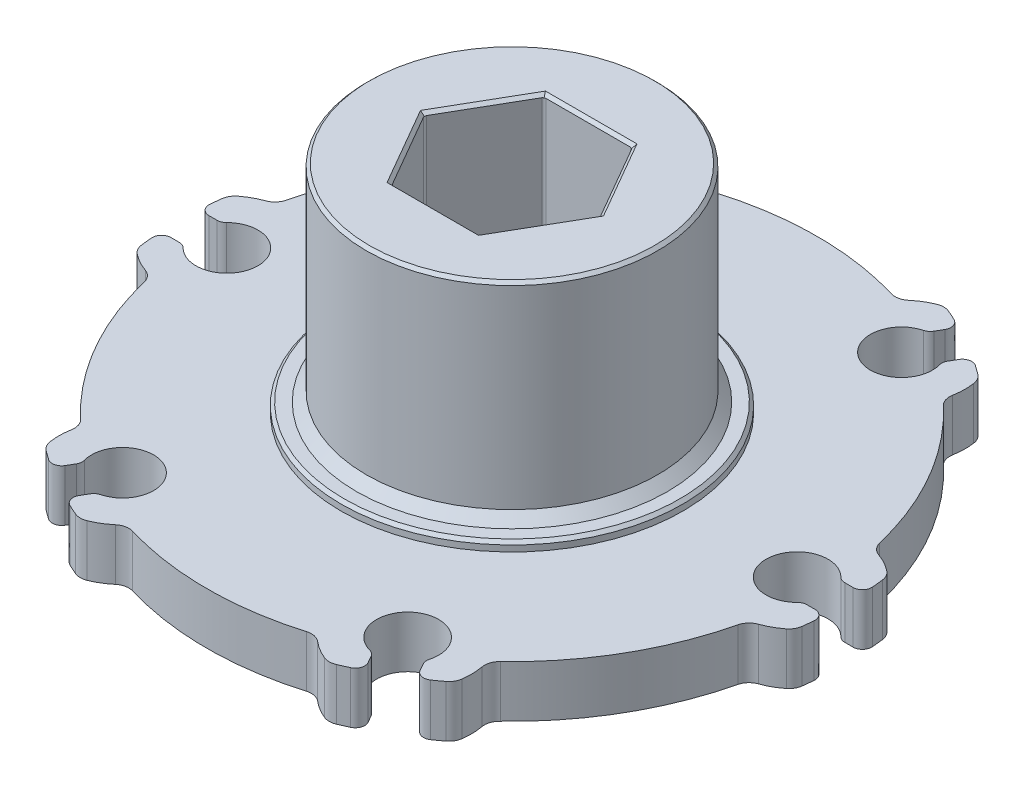
from build123d import *

# Parameters (mm, degrees)
BOSS_EXTRUDE1_DEPTH = 4.318
SKETCH2_R           = 14.2748
BOSS_EXTRUDE2_DEPTH = 0.762
SKETCH3_R           = 12.1666
BOSS_EXTRUDE3_DEPTH = 17.272
BOSS_EXTRUDE4_START = 1.524
SKETCH4_R           = 14.2748
BOSS_EXTRUDE4_DEPTH = 1.524
SKETCH5_R           = 9.23823544
BOSS_EXTRUDE5_DEPTH = 1.524
CUT_EXTRUDE1_DEPTH  = 46.584149412
CHAMFER1_SIZE       = 0.254
CHAMFER2_SIZE       = 0.8128
FILLET1_R           = 0.254
FILLET2_R           = 0.7874
FILLET3_R           = 1.27


with BuildPart() as part:
    # Sketch1 → Boss-Extrude1 (new body)
    with BuildSketch(Plane(origin=(0, 0, 0), x_dir=(1, 0, 0), z_dir=(0, 1, 0))):
        with BuildLine():
            Line((-15.245923409, -23.231713952), (-14.304794833, -21.601631442))
            ThreePointArc((-14.304794833, -21.601631442), (-10.61085, -18.378531311), (-11.555164176, -23.189131442))
            Line((-11.555164176, -23.189131442), (-12.496292752, -24.819213952))
            ThreePointArc((-12.496292752, -24.819213952), (-11.478399272, -25.306067729), (-10.441580035, -25.75119648))
            ThreePointArc((-10.441580035, -25.75119648), (-9.094716178, -25.155091448), (-7.962227062, -24.213363323))
            ThreePointArc((-7.962227062, -24.213363323), (0, -25.4889), (7.962227062, -24.213363323))
            ThreePointArc((7.962227062, -24.213363323), (9.094716178, -25.155091448), (10.441580035, -25.75119648))
            ThreePointArc((10.441580035, -25.75119648), (11.478399272, -25.306067729), (12.496292752, -24.819213952))
            Line((12.496292752, -24.819213952), (11.555164176, -23.189131442))
            ThreePointArc((11.555164176, -23.189131442), (10.61085, -18.378531311), (14.304794833, -21.601631442))
            Line((14.304794833, -21.601631442), (15.245923409, -23.231713952))
            ThreePointArc((15.245923409, -23.231713952), (16.176497887, -22.593619229), (17.080400312, -21.918271806))
            ThreePointArc((17.080400312, -21.918271806), (17.23759014, -20.453800974), (16.988274218, -19.002172568))
            ThreePointArc((16.988274218, -19.002172568), (22.074034915, -12.74445), (24.95050128, -5.211190755))
            ThreePointArc((24.95050128, -5.211190755), (26.332306318, -4.701290474), (27.521980347, -3.832924674))
            ThreePointArc((27.521980347, -3.832924674), (27.654897159, -2.7124485), (27.742216161, -1.5875))
            Line((27.742216161, -1.5875), (25.859959008, -1.5875))
            ThreePointArc((25.859959008, -1.5875), (21.2217, 0), (25.859959008, 1.5875))
            Line((25.859959008, 1.5875), (27.742216161, 1.5875))
            ThreePointArc((27.742216161, 1.5875), (27.654897159, 2.7124485), (27.521980347, 3.832924674))
            ThreePointArc((27.521980347, 3.832924674), (26.332306318, 4.701290474), (24.95050128, 5.211190755))
            ThreePointArc((24.95050128, 5.211190755), (22.074034915, 12.74445), (16.988274218, 19.002172568))
            ThreePointArc((16.988274218, 19.002172568), (17.23759014, 20.453800974), (17.080400312, 21.918271806))
            ThreePointArc((17.080400312, 21.918271806), (16.176497887, 22.593619229), (15.245923409, 23.231713952))
            Line((15.245923409, 23.231713952), (14.304794833, 21.601631442))
            ThreePointArc((14.304794833, 21.601631442), (10.61085, 18.378531311), (11.555164176, 23.189131442))
            Line((11.555164176, 23.189131442), (12.496292752, 24.819213952))
            ThreePointArc((12.496292752, 24.819213952), (11.478399272, 25.306067729), (10.441580035, 25.75119648))
            ThreePointArc((10.441580035, 25.75119648), (9.094716178, 25.155091448), (7.962227062, 24.213363323))
            ThreePointArc((7.962227062, 24.213363323), (0, 25.4889), (-7.962227062, 24.213363323))
            ThreePointArc((-7.962227062, 24.213363323), (-9.094716178, 25.155091448), (-10.441580035, 25.75119648))
            ThreePointArc((-10.441580035, 25.75119648), (-11.478399272, 25.306067729), (-12.496292752, 24.819213952))
            Line((-12.496292752, 24.819213952), (-11.555164176, 23.189131442))
            ThreePointArc((-11.555164176, 23.189131442), (-10.61085, 18.378531311), (-14.304794833, 21.601631442))
            Line((-14.304794833, 21.601631442), (-15.245923409, 23.231713952))
            ThreePointArc((-15.245923409, 23.231713952), (-16.176497887, 22.593619229), (-17.080400312, 21.918271806))
            ThreePointArc((-17.080400312, 21.918271806), (-17.23759014, 20.453800974), (-16.988274218, 19.002172568))
            ThreePointArc((-16.988274218, 19.002172568), (-22.074034915, 12.74445), (-24.95050128, 5.211190755))
            ThreePointArc((-24.95050128, 5.211190755), (-26.332306318, 4.701290474), (-27.521980347, 3.832924674))
            ThreePointArc((-27.521980347, 3.832924674), (-27.654897159, 2.7124485), (-27.742216161, 1.5875))
            Line((-27.742216161, 1.5875), (-25.859959008, 1.5875))
            ThreePointArc((-25.859959008, 1.5875), (-21.2217, 0), (-25.859959008, -1.5875))
            Line((-25.859959008, -1.5875), (-27.742216161, -1.5875))
            ThreePointArc((-27.742216161, -1.5875), (-27.654897159, -2.7124485), (-27.521980347, -3.832924674))
            ThreePointArc((-27.521980347, -3.832924674), (-26.332306318, -4.701290474), (-24.95050128, -5.211190755))
            ThreePointArc((-24.95050128, -5.211190755), (-22.074034915, -12.74445), (-16.988274218, -19.002172568))
            ThreePointArc((-16.988274218, -19.002172568), (-17.23759014, -20.453800974), (-17.080400312, -21.918271806))
            ThreePointArc((-17.080400312, -21.918271806), (-16.176497887, -22.593619229), (-15.245923409, -23.231713952))
        make_face()
    extrude(amount=-BOSS_EXTRUDE1_DEPTH)

    # Sketch2 → Boss-Extrude2 (add)
    with BuildSketch(Plane(origin=(0, 0, 0), x_dir=(-1, 0, 0), z_dir=(0, 1, 0))):
        with Locations(Location((0, 0, 0), (0, 0, 90))):
            Circle(SKETCH2_R)
    extrude(amount=BOSS_EXTRUDE2_DEPTH)

    # Sketch3 → Boss-Extrude3 (add)
    with BuildSketch(Plane(origin=(0, 0.762, 0), x_dir=(-1, 0, 0), z_dir=(0, 1, 0))):
        with Locations(Location((0, 0, 0), (0, 0, 90))):
            Circle(SKETCH3_R)
    extrude(amount=BOSS_EXTRUDE3_DEPTH)

    # Sketch4 → Boss-Extrude4 (add)
    with BuildSketch(Plane.XZ.offset(4.318).offset(BOSS_EXTRUDE4_START)):
        with Locations(Location((0, 0, 0), (0, 0, 90))):
            Circle(SKETCH4_R)
    extrude(amount=-BOSS_EXTRUDE4_DEPTH)

    # Sketch5 → Boss-Extrude5 (add)
    with BuildSketch(Plane.XZ.offset(5.842)):
        with Locations(Location((0, 0, 0), (0, 0, 90))):
            Circle(SKETCH5_R)
    extrude(amount=BOSS_EXTRUDE5_DEPTH)

    # Sketch6 → Cut-Extrude1 (cut, through all)
    with BuildSketch(Plane.XZ.offset(7.366)):
        Polygon((7.347013, 0), (3.6735065, 6.3626999), (-3.6735065, 6.3626999), (-7.347013, 0), (-3.6735065, -6.3626999), (3.6735065, -6.3626999), align=None)
    extrude(amount=-CUT_EXTRUDE1_DEPTH, mode=Mode.SUBTRACT)

    # Chamfer1
    chamfer1_edges = [part.edges().sort_by_distance(p)[0] for p in [
        (0, 0.762, -14.2748),
        (0, 18.034, -12.1666),
        (0, -5.842, -14.2748),
        (0, -7.366, -9.23823544),
        (5.51025975, 18.034, -3.18134995),
        (0, 18.034, -6.3626999),
        (-5.51025975, 18.034, -3.18134995),
        (-5.51025975, 18.034, 3.18134995),
        (0, 18.034, 6.3626999),
        (5.51025975, 18.034, 3.18134995),
        (5.51025975, -7.366, -3.18134995),
        (5.51025975, -7.366, 3.18134995),
        (0, -7.366, 6.3626999),
        (-5.51025975, -7.366, 3.18134995),
        (-5.51025975, -7.366, -3.18134995),
        (0, -7.366, -6.3626999),
    ]]
    chamfer(chamfer1_edges, length=CHAMFER1_SIZE)

    # Chamfer2
    chamfer2_edges = [part.edges().sort_by_distance(p)[0] for p in [
        (0, 0.762, -12.1666),
    ]]
    chamfer(chamfer2_edges, length=CHAMFER2_SIZE)

    # Fillet1
    fillet1_edges = [part.edges().sort_by_distance(p)[0] for p in [
        (0, -4.318, -14.2748),
        (-3.6735065, 5.334, -6.3626999),
        (-7.347013, 5.334, 0),
        (-3.6735065, 5.334, 6.3626999),
        (3.6735065, 5.334, 6.3626999),
        (7.347013, 5.334, 0),
        (3.6735065, 5.334, -6.3626999),
    ]]
    fillet(fillet1_edges, radius=FILLET1_R)

    # Fillet2
    fillet2_edges = [part.edges().sort_by_distance(p)[0] for p in [
        (-27.742216161, -2.159, 1.5875),
        (-25.859959008, -2.159, 1.5875),
        (-25.859959008, -2.159, -1.5875),
        (-27.742216161, -2.159, -1.5875),
        (-15.245923409, -2.159, -23.231713952),
        (-14.304794833, -2.159, -21.601631442),
        (-11.555164176, -2.159, -23.189131442),
        (-12.496292752, -2.159, -24.819213952),
        (12.496292752, -2.159, -24.819213952),
        (11.555164176, -2.159, -23.189131442),
        (14.304794833, -2.159, -21.601631442),
        (15.245923409, -2.159, -23.231713952),
        (27.742216161, -2.159, -1.5875),
        (25.859959008, -2.159, -1.5875),
        (25.859959008, -2.159, 1.5875),
        (27.742216161, -2.159, 1.5875),
        (15.245923409, -2.159, 23.231713952),
        (14.304794833, -2.159, 21.601631442),
        (11.555164176, -2.159, 23.189131442),
        (12.496292752, -2.159, 24.819213952),
        (-12.496292752, -2.159, 24.819213952),
        (-11.555164176, -2.159, 23.189131442),
        (-14.304794833, -2.159, 21.601631442),
        (-15.245923409, -2.159, 23.231713952),
    ]]
    fillet(fillet2_edges, radius=FILLET2_R)

    # Fillet3
    fillet3_edges = [part.edges().sort_by_distance(p)[0] for p in [
        (-27.521980347, -2.159, 3.832924674),
        (-27.521980347, -2.159, -3.832924674),
        (-24.95050128, -2.159, -5.211190755),
        (-16.988274218, -2.159, -19.002172568),
        (-17.080400312, -2.159, -21.918271806),
        (-10.441580035, -2.159, -25.75119648),
        (-7.962227062, -2.159, -24.213363323),
        (7.962227062, -2.159, -24.213363323),
        (10.441580035, -2.159, -25.75119648),
        (17.080400312, -2.159, -21.918271806),
        (16.988274218, -2.159, -19.002172568),
        (24.95050128, -2.159, -5.211190755),
        (27.521980347, -2.159, -3.832924674),
        (27.521980347, -2.159, 3.832924674),
        (24.95050128, -2.159, 5.211190755),
        (16.988274218, -2.159, 19.002172568),
        (17.080400312, -2.159, 21.918271806),
        (10.441580035, -2.159, 25.75119648),
        (7.962227062, -2.159, 24.213363323),
        (-7.962227062, -2.159, 24.213363323),
        (-10.441580035, -2.159, 25.75119648),
        (-17.080400312, -2.159, 21.918271806),
        (-16.988274218, -2.159, 19.002172568),
        (-24.95050128, -2.159, 5.211190755),
    ]]
    fillet(fillet3_edges, radius=FILLET3_R)


solid = part.part
